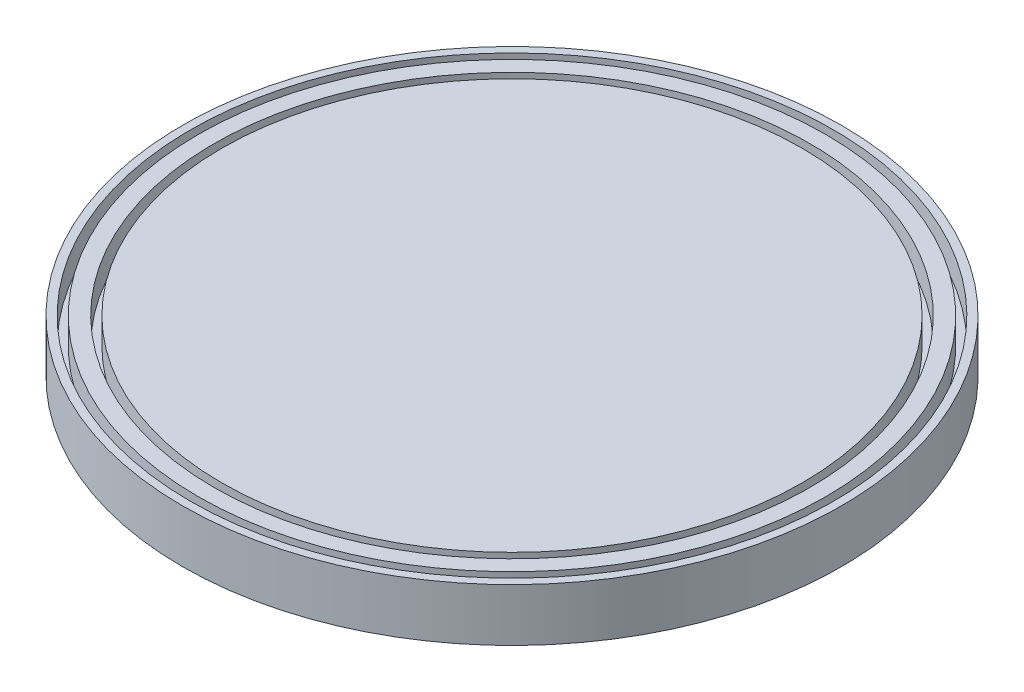
from build123d import *

# Parameters (mm, degrees)
SKETCH2_R           = 62.5
BOSS_EXTRUDE1_DEPTH = 10
SKETCH3_R           = 61
SKETCH3_R_2         = 59.5
SKETCH3_R_3         = 56.5
SKETCH3_R_4         = 55
CUT_EXTRUDE1_DEPTH  = 5


with BuildPart() as part:
    # Sketch2 → Boss-Extrude1 (new body)
    with BuildSketch(Plane(origin=(0, 0, 0), x_dir=(1, 0, 0), z_dir=(0, 1, 0))):
        with Locations(Location((0, 0, 0), (0, 0, 270))):
            Circle(SKETCH2_R)
    extrude(amount=BOSS_EXTRUDE1_DEPTH)

    # Sketch3 → Cut-Extrude1 (cut)
    # profile 1 of 2: a face of its own
    with BuildSketch(Plane(origin=(0, 10, 0), x_dir=(1, 0, 0), z_dir=(0, 1, 0))):
        with Locations(Location((0, 0, 0), (0, 0, 270))):
            Circle(SKETCH3_R)
        with Locations(Location((0, 0, 0), (0, 0, 270))):
            Circle(SKETCH3_R_2, mode=Mode.SUBTRACT)
    # profile 2 of 2: a face of its own
    with BuildSketch(Plane(origin=(0, 10, 0), x_dir=(1, 0, 0), z_dir=(0, 1, 0))):
        with Locations(Location((0, 0, 0), (0, 0, 270))):
            Circle(SKETCH3_R_3)
        with Locations(Location((0, 0, 0), (0, 0, 270))):
            Circle(SKETCH3_R_4, mode=Mode.SUBTRACT)
    extrude(amount=-CUT_EXTRUDE1_DEPTH, mode=Mode.SUBTRACT)


solid = part.part
